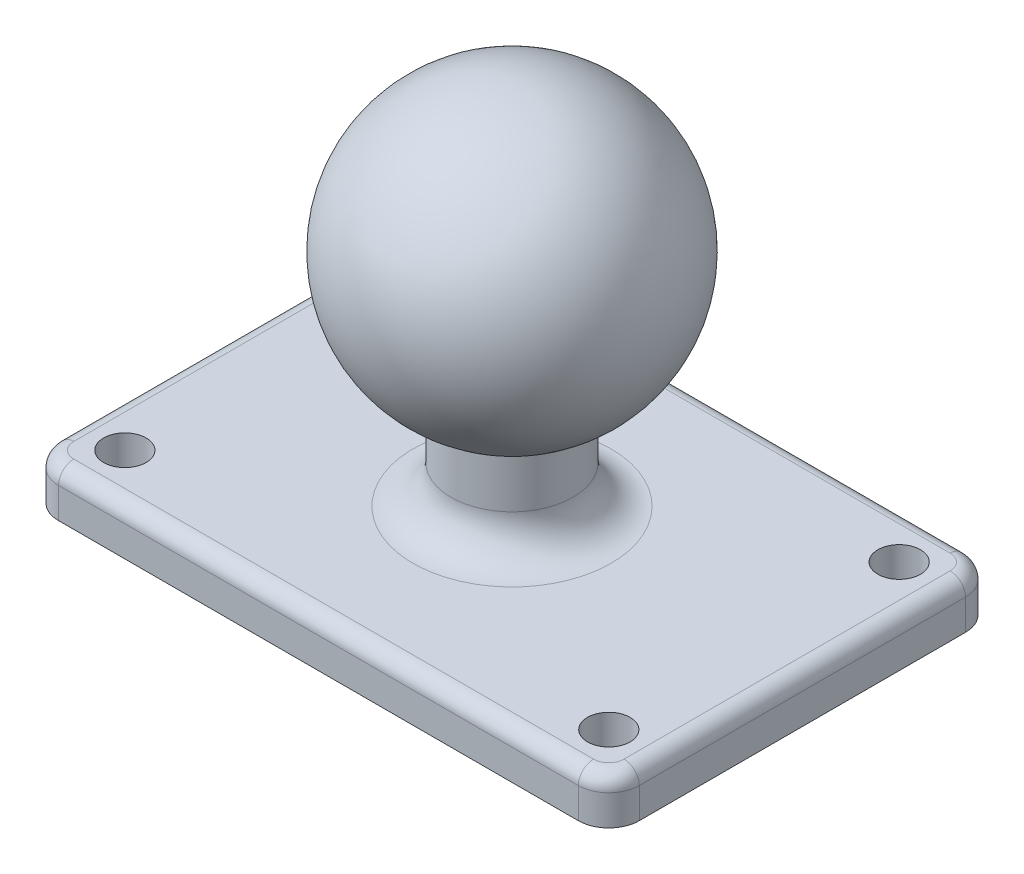
from build123d import *

# Parameters (mm, degrees)
SKETCH1_R           = 2.794
BOSS_EXTRUDE1_DEPTH = 6
FILLET1_R           = 5
FILLET2_R           = 2


with BuildPart() as part:
    # Sketch1 → Boss-Extrude1 (new body)
    with BuildSketch(Plane(origin=(0, 0, 0), x_dir=(1, 0, 0), z_dir=(0, 1, 0))):
        with BuildLine():
            Line((-34.1, -25.4), (34.1, -25.4))
            ThreePointArc((34.1, -25.4), (36.928427125, -24.228427125), (38.1, -21.4))
            Line((38.1, -21.4), (38.1, 21.4))
            ThreePointArc((38.1, 21.4), (36.928427125, 24.228427125), (34.1, 25.4))
            Line((34.1, 25.4), (-34.1, 25.4))
            ThreePointArc((-34.1, 25.4), (-36.928427125, 24.228427125), (-38.1, 21.4))
            Line((-38.1, 21.4), (-38.1, -21.4))
            ThreePointArc((-38.1, -21.4), (-36.928427125, -24.228427125), (-34.1, -25.4))
        make_face()
        with Locations(Location((-31.75, 19.05, 0), (0, 0, 270))):
            Circle(SKETCH1_R, mode=Mode.SUBTRACT)
        with Locations(Location((31.75, 19.05, 0), (0, 0, 270))):
            Circle(SKETCH1_R, mode=Mode.SUBTRACT)
        with Locations(Location((31.75, -19.05, 0), (0, 0, 270))):
            Circle(SKETCH1_R, mode=Mode.SUBTRACT)
        with Locations(Location((-31.75, -19.05, 0), (0, 0, 270))):
            Circle(SKETCH1_R, mode=Mode.SUBTRACT)
    extrude(amount=BOSS_EXTRUDE1_DEPTH)

    # Sketch2 → Revolve1 (revolve)
    with BuildSketch(Plane.XY, mode=Mode.PRIVATE) as revolve1_sk:
        with BuildLine():
            Line((0, 6), (0, 54.022796951))
            ThreePointArc((0, 54.022796951), (-18.604489806, 39.068582473), (-8, 17.684))
            Line((-8, 17.684), (-8, 6))
            Line((-8, 6), (0, 6))
        make_face()
    revolve(revolve1_sk.sketch.rotate(Axis((0, 6, 0), (0, 1, 0)), 180), axis=Axis((0, 6, 0), (0, 1, 0)))

    # Fillet1
    fillet1_edges = [part.edges().sort_by_distance(p)[0] for p in [
        (-8, 6, 0),
    ]]
    fillet(fillet1_edges, radius=FILLET1_R)

    # Fillet2
    fillet2_edges = [part.edges().sort_by_distance(p)[0] for p in [
        (-36.928427125, 6, -24.228427125),
        (-38.1, 6, 0),
        (-36.928427125, 6, 24.228427125),
        (0, 6, 25.4),
        (36.928427125, 6, 24.228427125),
        (38.1, 6, 0),
        (36.928427125, 6, -24.228427125),
        (0, 6, -25.4),
    ]]
    fillet(fillet2_edges, radius=FILLET2_R)


solid = part.part
